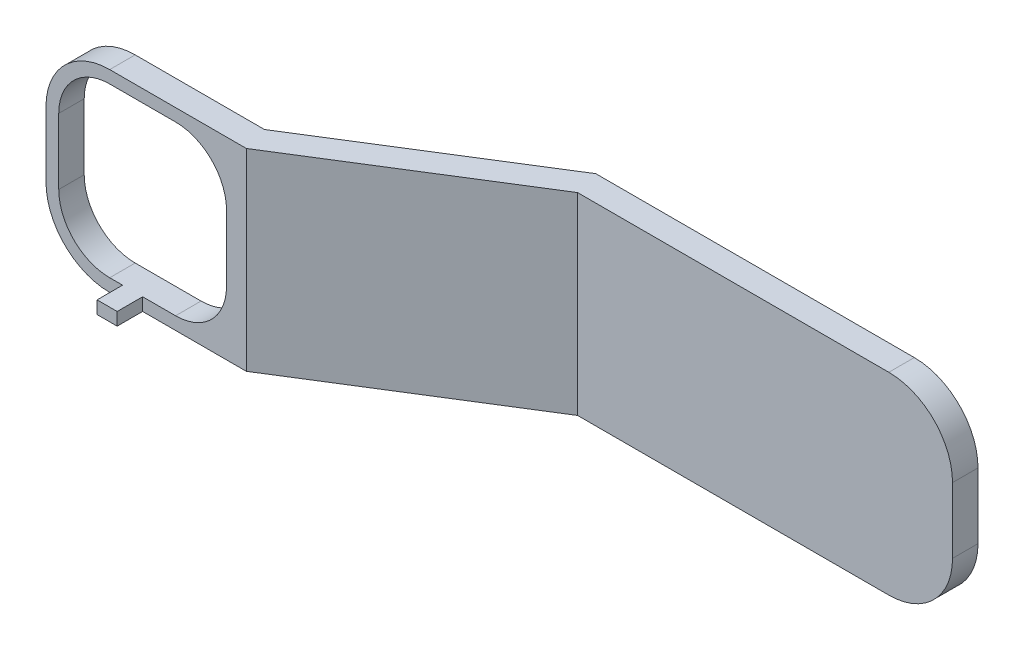
from build123d import *

# Parameters (mm, degrees)
EXTRUDE_THIN1_DEPTH = 9.62000108
CUT_EXTRUDE1_DEPTH  = 80.723760299
FILLET1_R           = 6.35
SKETCH4_W           = 2.00000108
SKETCH4_H           = 1.27
BOSS_EXTRUDE1_DEPTH = 2.54
SCALE1_SCALE        = 2.54


with BuildPart() as part:
    # Sketch2 → Extrude-Thin1 (new, symmetric)
    with BuildSketch(Plane(origin=(0, 0, 0), x_dir=(1, 0, 0), z_dir=(0, 1, 0))):
        Polygon((0, 0), (19.24000216, 0), (39.56000216, 12.7), (77.66000216, 12.7), (77.66000216, 10.16), (40.288464575, 10.16), (19.968464575, -2.54), (0, -2.54), align=None)
    extrude(amount=EXTRUDE_THIN1_DEPTH, both=True)

    # Sketch3 → Cut-Extrude1 (cut, through all)
    with BuildSketch(Plane.XY.offset(2.54)):
        with BuildLine():
            Line((6.35, 8.37540108), (12.91540216, 8.37540108))
            ThreePointArc((12.91540216, 8.37540108), (16.507504608, 6.887503528), (17.99540216, 3.29540108))
            Line((17.99540216, 3.29540108), (17.99540216, -3.27000108))
            ThreePointArc((17.99540216, -3.27000108), (16.507504608, -6.862103528), (12.91540216, -8.35000108))
            Line((12.91540216, -8.35000108), (6.35, -8.35000108))
            ThreePointArc((6.35, -8.35000108), (2.757897552, -6.862103528), (1.27, -3.27000108))
            Line((1.27, -3.27000108), (1.27, 3.29540108))
            ThreePointArc((1.27, 3.29540108), (2.757897552, 6.887503528), (6.35, 8.37540108))
        make_face()
    extrude(amount=-CUT_EXTRUDE1_DEPTH, mode=Mode.SUBTRACT)

    # Fillet1
    fillet1_edges = [part.edges().sort_by_distance(p)[0] for p in [
        (0, 9.62000108, 1.27),
        (0, -9.62000108, 1.27),
        (77.66000216, 9.62000108, -11.43),
        (77.66000216, -9.62000108, -11.43),
    ]]
    fillet(fillet1_edges, radius=FILLET1_R)

    # Sketch4 → Boss-Extrude1 (add)
    with BuildSketch(Plane.XY.offset(2.54)):
        with Locations((8.63270054, -8.98500108)):
            Rectangle(SKETCH4_W, SKETCH4_H)
    extrude(amount=BOSS_EXTRUDE1_DEPTH)


with BuildPart() as part_1:
    # Scale1: scaled about (44.171942925, -0.020471779, -8.083535651)
    add(part.part.scale(SCALE1_SCALE).moved(Location((-68.024792105, 0.03152654, 12.448644903))))


solid = part_1.part
